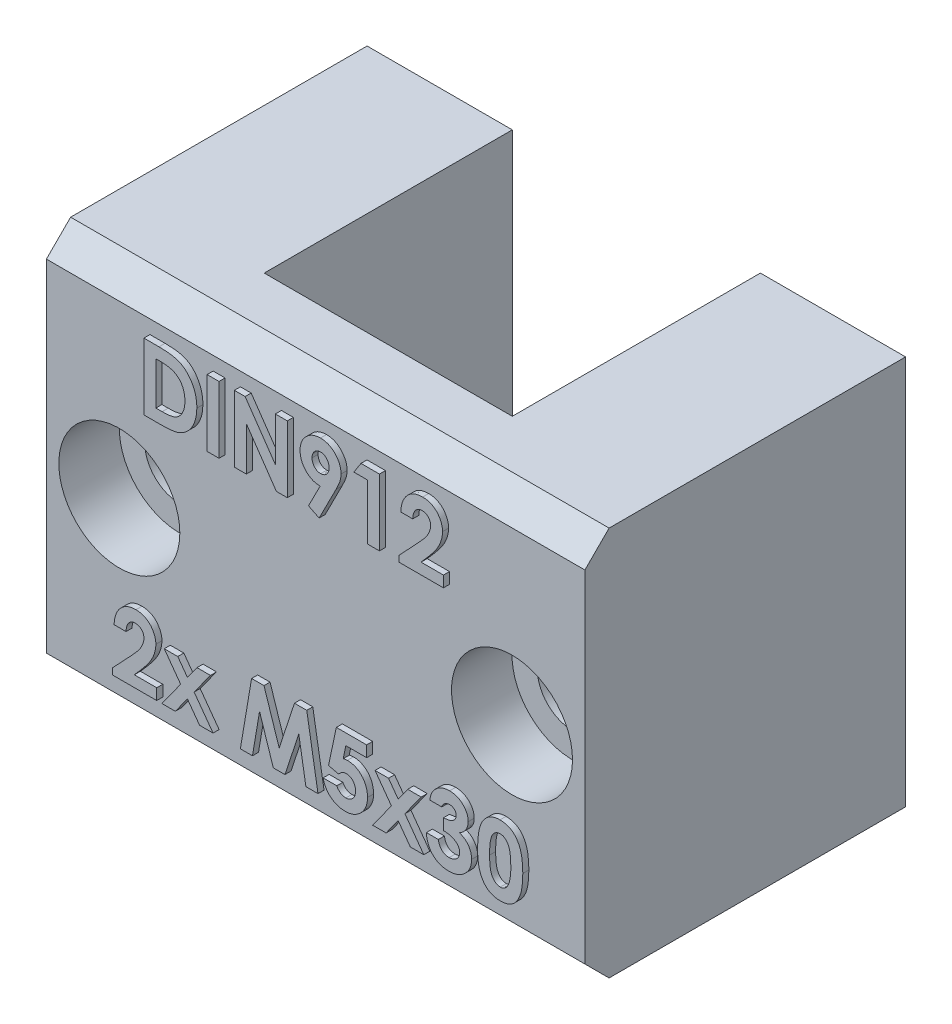
from build123d import *

# Parameters (mm, degrees)
SKETCH1_W                                           = 44.5
SKETCH1_H                                           = 32.2
BOSS_EXTRUDE1_DEPTH                                 = 6
SKETCH2_W                                           = 12
SKETCH2_H                                           = 32.2
BOSS_EXTRUDE2_DEPTH                                 = 20.5
CBORE_FOR_M5_HEX_SOCKET_HEAD_CAP_SCREW1_D           = 5.8
CBORE_FOR_M5_HEX_SOCKET_HEAD_CAP_SCREW1_CBORE_D     = 10
CBORE_FOR_M5_HEX_SOCKET_HEAD_CAP_SCREW1_CBORE_DEPTH = 5
SKETCH6_W                                           = 18.5
SKETCH6_H                                           = 30.2
CUT_EXTRUDE1_DEPTH                                  = 1
CHAMFER1_SIZE                                       = 2
SKETCH7_W                                           = 0.987179487
SKETCH7_H                                           = 5.5
BOSS_EXTRUDE3_DEPTH                                 = 0.5


with BuildPart() as part:
    # Sketch1 → Boss-Extrude1 (new body)
    with BuildSketch(Plane.XY):
        with Locations((22.25, 16.1)):
            Rectangle(SKETCH1_W, SKETCH1_H)
    extrude(amount=BOSS_EXTRUDE1_DEPTH)

    # Sketch2 → Boss-Extrude2 (add)
    with BuildSketch(Plane(origin=(0, 0, 0), x_dir=(-1, 0, 0), z_dir=(0, 0, -1))):
        with Locations((-38.5, 16.1)):
            Rectangle(SKETCH2_W, SKETCH2_H)
        with Locations((-6, 16.1)):
            Rectangle(SKETCH2_W, SKETCH2_H)
    extrude(amount=BOSS_EXTRUDE2_DEPTH)

    # CBORE for M5 Hex Socket Head Cap Screw1 (through all)
    with Locations(Plane.XY.offset(6)):
        with Locations((6.025, 16.1), (38.475, 16.1)):
            CounterBoreHole(CBORE_FOR_M5_HEX_SOCKET_HEAD_CAP_SCREW1_D / 2, CBORE_FOR_M5_HEX_SOCKET_HEAD_CAP_SCREW1_CBORE_D / 2, CBORE_FOR_M5_HEX_SOCKET_HEAD_CAP_SCREW1_CBORE_DEPTH)

    # Sketch6 → Cut-Extrude1 (cut)
    with BuildSketch(Plane(origin=(0, 0, 0), x_dir=(-1, 0, 0), z_dir=(0, 0, -1))):
        with Locations((-22.25, 16.1)):
            Rectangle(SKETCH6_W, SKETCH6_H)
    extrude(amount=-CUT_EXTRUDE1_DEPTH, mode=Mode.SUBTRACT)

    # Chamfer1
    chamfer1_edges = [part.edges().sort_by_distance(p)[0] for p in [
        (22.25, 32.2, 6),
        (22.25, 0, 6),
    ]]
    chamfer(chamfer1_edges, length=CHAMFER1_SIZE)

    # Sketch7 → Boss-Extrude3 (add)
    # profile 1 of 13: a face of its own
    with BuildSketch(Plane.XY.offset(6)):
        with BuildLine():
            Line((8.558580457, 29.075557716), (9.802470681, 29.075557716))
            add(Edge.make_bspline(
                [(9.802470681, 29.075557716), (9.899446232, 29.074879824), (10.086901067, 29.07356945), (10.358486038, 29.058804693), (10.611025501, 29.036097544), (10.844682249, 29.004859746), (11.058977246, 28.963523584), (11.253634165, 28.911675471), (11.429306319, 28.85182545), (11.587919919, 28.781399756), (11.73271888, 28.69929039), (11.870210114, 28.607827149), (12.000123662, 28.503659466), (12.124282653, 28.388796945), (12.241084791, 28.261138209), (12.352475248, 28.122797751), (12.455726682, 27.971769442), (12.55396016, 27.811674467), (12.642799269, 27.641834356), (12.720288059, 27.463694754), (12.785200889, 27.278402056), (12.837945924, 27.085758787), (12.879989805, 26.886404466), (12.909407061, 26.679936812), (12.927593101, 26.466546982), (12.929437923, 26.321922217), (12.930375329, 26.248434319)],
                knots=[0, 0, 0, 0, 1.44355588, 2.790409838, 4.047694926, 5.217575253, 6.298404546, 7.294384826, 8.214239204, 9.058592145, 9.873746385, 10.689560431, 11.514393297, 12.350027578, 13.205127629, 14.088021785, 14.991911688, 15.926770944, 16.882954281, 17.842803888, 18.816321264, 19.80318086, 20.814351908, 21.847355356, 22.906180909, 24, 24, 24, 24], degree=3))
            add(Edge.make_bspline(
                [(12.930375329, 26.248434319), (12.927920695, 26.144738112), (12.923088604, 25.940606058), (12.88238577, 25.641044621), (12.816555505, 25.353885105), (12.723992173, 25.081373785), (12.609238421, 24.825937413), (12.472152214, 24.592080503), (12.314743555, 24.381058279), (12.138846264, 24.193921461), (11.948392339, 24.03307483), (11.750472304, 23.89532146), (11.54315806, 23.786691434), (11.360485237, 23.717803753), (11.20208511, 23.674961575), (11.063011513, 23.649641436), (10.905038096, 23.626421341), (10.726691895, 23.608477351), (10.528755276, 23.592475721), (10.310439262, 23.583781059), (10.072450696, 23.576557085), (9.907145136, 23.575899568), (9.821200649, 23.575557716)],
                knots=[0, 0, 0, 0, 1.315458931, 2.589557908, 3.828601765, 5.048913369, 6.235739168, 7.376350998, 8.481830359, 9.569842114, 10.627874879, 11.640079404, 12.624025415, 13.590060155, 14.111227486, 14.704434459, 15.382649715, 16.137166398, 16.978595427, 17.902333227, 18.909396075, 20, 20, 20, 20], degree=3))
            Line((9.821200649, 23.575557716), (8.558580457, 23.575557716))
            Line((8.558580457, 23.575557716), (8.558580457, 29.075557716))
        make_face()
        with BuildLine():
            Line((9.545759944, 28.088378229), (9.545759944, 24.562737203))
            Line((9.545759944, 24.562737203), (10.061384944, 24.562737203))
            add(Edge.make_bspline(
                [(10.061384944, 24.562737203), (10.1227364, 24.562849625), (10.240735675, 24.563065848), (10.411099916, 24.573364761), (10.568643643, 24.58370203), (10.712933173, 24.603322512), (10.845018601, 24.625178347), (10.96308542, 24.655593736), (11.069567498, 24.687542524), (11.163164179, 24.728217292), (11.248891112, 24.773999451), (11.328264461, 24.827638557), (11.404881965, 24.887202761), (11.477311199, 24.954443932), (11.545826289, 25.028471669), (11.610021857, 25.109667406), (11.670754745, 25.197783411), (11.726466054, 25.293285575), (11.777375346, 25.395165374), (11.822537593, 25.502435954), (11.859983759, 25.615990648), (11.891106721, 25.734766447), (11.913347605, 25.859797429), (11.931747695, 25.990157507), (11.941233478, 26.126363156), (11.942535343, 26.219042033), (11.943195842, 26.266062524)],
                knots=[0, 0, 0, 0, 1.50275155, 2.890291501, 4.180787663, 5.369391935, 6.45668281, 7.458360028, 8.354766181, 9.177074746, 9.954075863, 10.732690366, 11.5210699, 12.329727389, 13.151100085, 13.990027547, 14.863562427, 15.770965086, 16.696477834, 17.652329173, 18.619756807, 19.62365428, 20.657822005, 21.729286259, 22.847956731, 24, 24, 24, 24], degree=3))
            add(Edge.make_bspline(
                [(11.943195842, 26.266062524), (11.941880352, 26.338116982), (11.939315248, 26.478617591), (11.914577947, 26.683259796), (11.874310339, 26.875961089), (11.816852342, 27.056006303), (11.744424757, 27.22390146), (11.65376475, 27.378224133), (11.54877398, 27.52156673), (11.465750143, 27.605656097), (11.424265553, 27.647673101)],
                knots=[0, 0, 0, 0, 1.13821349, 2.219428113, 3.251817212, 4.244760574, 5.201143372, 6.134805572, 7.068016741, 8, 8, 8, 8], degree=3))
            add(Edge.make_bspline(
                [(11.424265553, 27.647673101), (11.383357819, 27.683477269), (11.299808405, 27.756603227), (11.15312309, 27.844226826), (10.99148347, 27.921212746), (10.811191714, 27.982253995), (10.613990264, 28.030528017), (10.398704582, 28.06382143), (10.16648757, 28.085215424), (10.005613035, 28.087301374), (9.922562829, 28.088378229)],
                knots=[0, 0, 0, 0, 0.813307809, 1.661089106, 2.549956539, 3.493439533, 4.508053171, 5.589449661, 6.755572447, 8, 8, 8, 8], degree=3))
            Line((9.922562829, 28.088378229), (9.545759944, 28.088378229))
        make_face(mode=Mode.SUBTRACT)
    # profile 2 of 13: a face of its own
    with BuildSketch(Plane.XY.offset(6)):
        with Locations((14.270118918, 26.325557716)):
            Rectangle(SKETCH7_W, SKETCH7_H)
    # profile 3 of 13: a face of its own
    with BuildSketch(Plane.XY.offset(6)):
        Polygon((16.032939431, 29.075557716), (16.922062027, 29.075557716), (19.417554816, 25.456266851), (19.417554816, 29.075557716), (20.404734303, 29.075557716), (20.404734303, 23.575557716), (19.50900113, 23.575557716), (17.020118919, 27.183830953), (17.020118919, 23.575557716), (16.032939431, 23.575557716), align=None)
    # profile 4 of 13: a face of its own
    with BuildSketch(Plane.XY.offset(6)):
        with BuildLine():
            Line((23.035743919, 23.434532075), (22.160944239, 23.875237203))
            Line((22.160944239, 23.875237203), (23.119477893, 25.761455152))
            add(Edge.make_bspline(
                [(23.119477893, 25.761455152), (23.062845524, 25.762898636), (22.951662483, 25.765732544), (22.787954127, 25.789282293), (22.631403769, 25.829483218), (22.480166194, 25.883000777), (22.33633297, 25.954746609), (22.198160005, 26.040371496), (22.067560079, 26.143248566), (21.943920864, 26.258886646), (21.831034309, 26.386704156), (21.733051168, 26.524169725), (21.64764759, 26.667796254), (21.581233083, 26.820826216), (21.527888613, 26.980407512), (21.488912454, 27.147366153), (21.467040064, 27.322434646), (21.463982923, 27.441584348), (21.462426611, 27.502240409)],
                knots=[0, 0, 0, 0, 1.014336294, 1.991387562, 2.955278539, 3.906441712, 4.859855302, 5.829322156, 6.813833455, 7.833278715, 8.858926674, 9.863225732, 10.85404919, 11.846815163, 12.845559416, 13.865450493, 14.913355531, 16, 16, 16, 16], degree=3))
            add(Edge.make_bspline(
                [(21.462426611, 27.502240409), (21.463870175, 27.56107619), (21.466714689, 27.677010879), (21.490338649, 27.847165275), (21.529217574, 28.010538353), (21.582558065, 28.167102361), (21.653567833, 28.315801558), (21.73668296, 28.45896423), (21.838287431, 28.593628495), (21.953065917, 28.720377315), (22.078684878, 28.836330106), (22.211956052, 28.938280945), (22.352273473, 29.023502051), (22.497833924, 29.095072058), (22.651268515, 29.148544715), (22.810359945, 29.188889439), (22.976293339, 29.21217411), (23.088925467, 29.215101847), (23.145920201, 29.216583357)],
                knots=[0, 0, 0, 0, 1.055538678, 2.079917126, 3.075849687, 4.065898488, 5.041806164, 6.028602842, 7.031727914, 8.062953097, 9.093756959, 10.095582084, 11.068815425, 12.035667573, 13.000833448, 13.979119574, 14.977382875, 16, 16, 16, 16], degree=3))
            add(Edge.make_bspline(
                [(23.145920201, 29.216583357), (23.20551509, 29.215356661), (23.322700375, 29.212944528), (23.494243897, 29.186327599), (23.658369794, 29.14549236), (23.815744939, 29.090029775), (23.964415584, 29.014755568), (24.105625728, 28.924538906), (24.238905663, 28.817383686), (24.362824059, 28.696378455), (24.475526456, 28.564762626), (24.575423107, 28.426992605), (24.659340535, 28.28333777), (24.728074042, 28.135080192), (24.781617098, 27.981987608), (24.818421125, 27.823842861), (24.842854917, 27.660916387), (24.845634995, 27.550440197), (24.847041995, 27.494528069)],
                knots=[0, 0, 0, 0, 1.062826075, 2.08990367, 3.089830715, 4.078784409, 5.060762809, 6.057138927, 7.064407536, 8.107320944, 9.143871033, 10.153461498, 11.140480137, 12.108246174, 13.065926856, 14.029354859, 15.002654194, 16, 16, 16, 16], degree=3))
            add(Edge.make_bspline(
                [(24.847041995, 27.494528069), (24.846274182, 27.451885216), (24.844727633, 27.365992922), (24.829520792, 27.237188118), (24.806448948, 27.108026318), (24.779669191, 26.999433279), (24.75159434, 26.907895943), (24.724274313, 26.830243489), (24.689221915, 26.744034686), (24.650082408, 26.648691695), (24.604754253, 26.544632607), (24.552297654, 26.432354864), (24.495882943, 26.310193275), (24.454299732, 26.226660846), (24.432779175, 26.183430312)],
                knots=[0, 0, 0, 0, 1.105131805, 2.225983929, 3.357782449, 4.505488967, 5.122909461, 5.839607681, 6.638776516, 7.535249922, 8.51168636, 9.581005249, 10.748097757, 12, 12, 12, 12], degree=3))
            Line((24.432779175, 26.183430312), (23.035743919, 23.434532075))
        make_face()
        with BuildLine():
            add(Edge.make_bspline(
                [(23.167955457, 26.678121819), (23.215256985, 26.680906597), (23.307673461, 26.686347423), (23.440423583, 26.728417047), (23.559228193, 26.800409599), (23.664529031, 26.896052663), (23.751546421, 27.012741576), (23.814813757, 27.145581531), (23.853784489, 27.291821559), (23.857797584, 27.393653336), (23.859862508, 27.446050505)],
                knots=[0, 0, 0, 0, 0.984774978, 1.924027336, 2.867853169, 3.859505234, 4.871392407, 5.881338128, 6.909850265, 8, 8, 8, 8], degree=3))
            add(Edge.make_bspline(
                [(23.859862508, 27.446050505), (23.857375533, 27.499537656), (23.852537771, 27.603582935), (23.813193716, 27.753333284), (23.745962639, 27.888698718), (23.654498604, 28.006368558), (23.547715536, 28.104843182), (23.428305112, 28.176776243), (23.299166866, 28.221257342), (23.209798681, 28.22666961), (23.164650169, 28.22940387)],
                knots=[0, 0, 0, 0, 1.104110315, 2.147758178, 3.172670271, 4.206310416, 5.210906102, 6.157051016, 7.068948237, 8, 8, 8, 8], degree=3))
            add(Edge.make_bspline(
                [(23.164650169, 28.22940387), (23.116930725, 28.226738319), (23.023233987, 28.221504533), (22.888835053, 28.177130251), (22.764940334, 28.106578545), (22.656745891, 28.007769801), (22.56310775, 27.891649635), (22.497811318, 27.755827282), (22.456502531, 27.60712195), (22.451946243, 27.502890084), (22.449606098, 27.449355793)],
                knots=[0, 0, 0, 0, 0.970967322, 1.90648639, 2.855811969, 3.858352357, 4.877096915, 5.878517833, 6.91039038, 8, 8, 8, 8], degree=3))
            add(Edge.make_bspline(
                [(22.449606098, 27.449355793), (22.452050524, 27.396584594), (22.456804677, 27.293950122), (22.496649316, 27.14688071), (22.561552239, 27.013337754), (22.650279165, 26.895728583), (22.759568888, 26.799614275), (22.883658955, 26.728388589), (23.022078554, 26.686233351), (23.118454507, 26.680874335), (23.167955457, 26.678121819)],
                knots=[0, 0, 0, 0, 1.075706617, 2.092137047, 3.084482865, 4.090466434, 5.0784141, 6.035155512, 6.990809768, 8, 8, 8, 8], degree=3))
        make_face(mode=Mode.SUBTRACT)
    # profile 5 of 13: a face of its own
    with BuildSketch(Plane.XY.offset(6)):
        Polygon((26.494177412, 29.075557716), (28.020118919, 29.075557716), (28.020118919, 23.575557716), (27.032939431, 23.575557716), (27.032939431, 28.15889105), (25.904734303, 28.15889105), align=None)
    # profile 6 of 13: a face of its own
    with BuildSketch(Plane.XY.offset(6)):
        with BuildLine():
            Line((30.770118919, 27.242224383), (29.782939431, 27.242224383))
            add(Edge.make_bspline(
                [(29.782939431, 27.242224383), (29.787202908, 27.316899288), (29.795533486, 27.462809571), (29.828670418, 27.674748927), (29.873072771, 27.875008314), (29.932333605, 28.0628872), (30.00679872, 28.238317319), (30.094551937, 28.401896719), (30.197835152, 28.552764152), (30.314450157, 28.69019205), (30.442417152, 28.813479886), (30.579079415, 28.922794626), (30.72652738, 29.012998399), (30.882067052, 29.087227753), (31.045671946, 29.146533557), (31.218890021, 29.186184286), (31.400221462, 29.213036149), (31.524357516, 29.215385795), (31.587626931, 29.216583357)],
                knots=[0, 0, 0, 0, 1.199038563, 2.342849363, 3.436047546, 4.486744587, 5.497670872, 6.488682221, 7.459191391, 8.424610317, 9.374430501, 10.305433194, 11.225809216, 12.140057399, 13.06607119, 14.010487599, 14.985989317, 16, 16, 16, 16], degree=3))
            add(Edge.make_bspline(
                [(31.587626931, 29.216583357), (31.665289241, 29.214160088), (31.816904268, 29.2094293), (32.037212929, 29.169074103), (32.242957131, 29.101573801), (32.433987317, 29.007258078), (32.608677213, 28.887439838), (32.76699785, 28.744576196), (32.904161362, 28.575669799), (33.021037403, 28.387748565), (33.118147425, 28.188766426), (33.186198084, 27.983010644), (33.230927049, 27.775941141), (33.23569767, 27.636511018), (33.238067636, 27.567244415)],
                knots=[0, 0, 0, 0, 1.075374347, 2.099382735, 3.09057751, 4.06680945, 5.040638231, 6.016817125, 7.011024321, 8.044445721, 9.0776792, 10.070479129, 11.0414456, 12, 12, 12, 12], degree=3))
            add(Edge.make_bspline(
                [(33.238067636, 27.567244415), (33.237144897, 27.525347078), (33.235287649, 27.441018087), (33.222373963, 27.313407626), (33.20300088, 27.183421452), (33.173790994, 27.051171017), (33.137363871, 26.916619247), (33.093172505, 26.779363477), (33.040191835, 26.640181895), (32.979306, 26.497508037), (32.906669044, 26.350878697), (32.822093406, 26.198095843), (32.723334256, 26.039295007), (32.611584481, 25.873579547), (32.486301337, 25.701210822), (32.346873236, 25.52270806), (32.19490606, 25.337442275), (32.08705068, 25.213602494), (32.031637348, 25.149976787)],
                knots=[0, 0, 0, 0, 0.728284026, 1.46585585, 2.227944881, 3.01186502, 3.81876927, 4.650621989, 5.517437689, 6.406905708, 7.346299482, 8.360816762, 9.441613733, 10.596154504, 11.834900912, 13.145207542, 14.533280747, 16, 16, 16, 16], degree=3))
            Line((32.031637348, 25.149976787), (31.457618919, 24.492224383))
            Line((31.457618919, 24.492224383), (33.308580457, 24.492224383))
            Line((33.308580457, 24.492224383), (33.308580457, 23.575557716))
            Line((33.308580457, 23.575557716), (29.64191379, 23.575557716))
            Line((29.64191379, 23.575557716), (29.64191379, 24.075758037))
            Line((29.64191379, 24.075758037), (31.270319239, 25.808830953))
            add(Edge.make_bspline(
                [(31.270319239, 25.808830953), (31.317465761, 25.859385229), (31.408774594, 25.957293867), (31.538697652, 26.10108312), (31.656266544, 26.237535688), (31.759043381, 26.368104517), (31.85242176, 26.488554485), (31.932237948, 26.602516104), (31.999222198, 26.70895912), (32.071943102, 26.837310808), (32.141004056, 26.990393036), (32.204371661, 27.166750039), (32.242998602, 27.335306718), (32.248330341, 27.445141874), (32.250888149, 27.497833357)],
                knots=[0, 0, 0, 0, 1.246127091, 2.413378631, 3.493388633, 4.492180848, 5.408488754, 6.240484944, 6.999099869, 7.674939598, 8.898438119, 10.020720584, 11.050475521, 12, 12, 12, 12], degree=3))
            add(Edge.make_bspline(
                [(32.250888149, 27.497833357), (32.248975738, 27.548808302), (32.245270134, 27.647580431), (32.204548553, 27.788083259), (32.141461268, 27.915294226), (32.052562373, 28.025412127), (31.944877968, 28.115903307), (31.820438523, 28.183208105), (31.680258586, 28.222042665), (31.581989779, 28.226903364), (31.531437027, 28.22940387)],
                knots=[0, 0, 0, 0, 1.062038974, 2.057870785, 3.028805853, 4.01125022, 4.991535629, 5.949134679, 6.94496649, 8, 8, 8, 8], degree=3))
            add(Edge.make_bspline(
                [(31.531437027, 28.22940387), (31.505320832, 28.228480153), (31.453906908, 28.226661668), (31.378332458, 28.214556506), (31.306417939, 28.193222421), (31.237362902, 28.16463775), (31.171904322, 28.126748564), (31.110207305, 28.080044105), (31.051621796, 28.025711241), (30.99641649, 27.963919862), (30.946172456, 27.894960664), (30.901545888, 27.81946345), (30.864647145, 27.737475083), (30.832160151, 27.650077934), (30.807104627, 27.556333286), (30.788861097, 27.456802191), (30.774991759, 27.351646573), (30.771772747, 27.279361974), (30.770118919, 27.242224383)],
                knots=[0, 0, 0, 0, 0.903469896, 1.778625579, 2.63899355, 3.493148037, 4.358286772, 5.247621495, 6.164656832, 7.118446693, 8.109501108, 9.111810964, 10.146451449, 11.215617525, 12.33435995, 13.498009769, 14.714554818, 16, 16, 16, 16], degree=3))
        make_face()
    # profile 7 of 13: a face of its own
    with BuildSketch(Plane.XY.offset(6)):
        with BuildLine():
            Line((7.077811226, 7.331967973), (6.090631739, 7.331967973))
            add(Edge.make_bspline(
                [(6.090631739, 7.331967973), (6.094895216, 7.406642878), (6.103225794, 7.55255316), (6.136362726, 7.764492517), (6.180765078, 7.964751903), (6.240025912, 8.15263079), (6.314491027, 8.328060908), (6.402244245, 8.491640309), (6.505527459, 8.642507742), (6.622142465, 8.77993564), (6.75010946, 8.903223476), (6.886771723, 9.012538216), (7.034219688, 9.102741989), (7.18975936, 9.176971342), (7.353364254, 9.236277147), (7.526582329, 9.275927876), (7.707913769, 9.302779739), (7.832049824, 9.305129384), (7.895319239, 9.306326947)],
                knots=[0, 0, 0, 0, 1.199038563, 2.342849363, 3.436047546, 4.486744587, 5.497670872, 6.488682221, 7.459191391, 8.424610317, 9.374430501, 10.305433194, 11.225809216, 12.140057399, 13.06607119, 14.010487599, 14.985989317, 16, 16, 16, 16], degree=3))
            add(Edge.make_bspline(
                [(7.895319239, 9.306326947), (7.972981548, 9.303903678), (8.124596576, 9.29917289), (8.344905237, 9.258817693), (8.550649439, 9.191317391), (8.741679624, 9.097001668), (8.91636952, 8.977183427), (9.074690158, 8.834319786), (9.211853669, 8.665413388), (9.328729711, 8.477492155), (9.425839733, 8.278510016), (9.493890391, 8.072754233), (9.538619357, 7.865684731), (9.543389978, 7.726254608), (9.545759944, 7.656988005)],
                knots=[0, 0, 0, 0, 1.075374347, 2.099382735, 3.09057751, 4.06680945, 5.040638231, 6.016817125, 7.011024321, 8.044445721, 9.0776792, 10.070479129, 11.0414456, 12, 12, 12, 12], degree=3))
            add(Edge.make_bspline(
                [(9.545759944, 7.656988005), (9.544837204, 7.615090667), (9.542979957, 7.530761676), (9.53006627, 7.403151216), (9.510693188, 7.273165042), (9.481483302, 7.140914607), (9.445056178, 7.006362837), (9.400864813, 6.869107066), (9.347884142, 6.729925484), (9.286998307, 6.587251626), (9.214361352, 6.440622286), (9.129785714, 6.287839433), (9.031026564, 6.129038597), (8.919276788, 5.963323137), (8.793993645, 5.790954412), (8.654565543, 5.61245165), (8.502598367, 5.427185865), (8.394742988, 5.303346084), (8.339329656, 5.239720376)],
                knots=[0, 0, 0, 0, 0.728284026, 1.46585585, 2.227944881, 3.01186502, 3.81876927, 4.650621989, 5.517437689, 6.406905708, 7.346299482, 8.360816762, 9.441613733, 10.596154504, 11.834900912, 13.145207542, 14.533280747, 16, 16, 16, 16], degree=3))
            Line((8.339329656, 5.239720376), (7.765311226, 4.581967973))
            Line((7.765311226, 4.581967973), (9.616272765, 4.581967973))
            Line((9.616272765, 4.581967973), (9.616272765, 3.665301306))
            Line((9.616272765, 3.665301306), (5.949606098, 3.665301306))
            Line((5.949606098, 3.665301306), (5.949606098, 4.165501626))
            Line((5.949606098, 4.165501626), (7.578011547, 5.898574543))
            add(Edge.make_bspline(
                [(7.578011547, 5.898574543), (7.625158069, 5.949128818), (7.716466901, 6.047037457), (7.84638996, 6.190826709), (7.963958851, 6.327279278), (8.066735689, 6.457848107), (8.160114068, 6.578298074), (8.239930255, 6.692259694), (8.306914506, 6.79870271), (8.37963541, 6.927054398), (8.448696364, 7.080136626), (8.512063969, 7.256493629), (8.550690909, 7.425050308), (8.556022649, 7.534885463), (8.558580457, 7.587576947)],
                knots=[0, 0, 0, 0, 1.246127091, 2.413378631, 3.493388633, 4.492180848, 5.408488754, 6.240484944, 6.999099869, 7.674939598, 8.898438119, 10.020720584, 11.050475521, 12, 12, 12, 12], degree=3))
            add(Edge.make_bspline(
                [(8.558580457, 7.587576947), (8.556668046, 7.638551892), (8.552962442, 7.737324021), (8.512240861, 7.877826849), (8.449153576, 8.005037816), (8.360254681, 8.115155716), (8.252570276, 8.205646897), (8.128130831, 8.272951695), (7.987950893, 8.311786254), (7.889682086, 8.316646954), (7.839129335, 8.31914746)],
                knots=[0, 0, 0, 0, 1.062038974, 2.057870785, 3.028805853, 4.01125022, 4.991535629, 5.949134679, 6.94496649, 8, 8, 8, 8], degree=3))
            add(Edge.make_bspline(
                [(7.839129335, 8.31914746), (7.81301314, 8.318223743), (7.761599216, 8.316405258), (7.686024765, 8.304300096), (7.614110246, 8.282966011), (7.54505521, 8.25438134), (7.47959663, 8.216492154), (7.417899613, 8.169787695), (7.359314104, 8.11545483), (7.304108798, 8.053663451), (7.253864763, 7.984704254), (7.209238195, 7.90920704), (7.172339453, 7.827218673), (7.139852459, 7.739821523), (7.114796935, 7.646076876), (7.096553405, 7.546545781), (7.082684067, 7.441390163), (7.079465055, 7.369105564), (7.077811226, 7.331967973)],
                knots=[0, 0, 0, 0, 0.903469896, 1.778625579, 2.63899355, 3.493148037, 4.358286772, 5.247621495, 6.164656832, 7.118446693, 8.109501108, 9.111810964, 10.146451449, 11.215617525, 12.33435995, 13.498009769, 14.714554818, 16, 16, 16, 16], degree=3))
        make_face()
    # profile 8 of 13: a face of its own
    with BuildSketch(Plane.XY.offset(6)):
        Polygon((10.240972284, 7.684532075), (11.354854495, 7.684532075), (12.149225489, 6.589379832), (12.940291194, 7.684532075), (14.054173406, 7.684532075), (12.707819239, 5.81924762), (14.270118919, 3.665301306), (13.156236707, 3.665301306), (12.152530777, 5.049115409), (11.153231899, 3.665301306), (10.039349688, 3.665301306), (11.593937027, 5.81924762), align=None)
    # profile 9 of 13: a face of its own
    with BuildSketch(Plane.XY.offset(6)):
        Polygon((17.455315233, 9.165301306), (18.479954656, 9.165301306), (19.734862508, 5.328963165), (20.998584463, 9.165301306), (22.013308021, 9.165301306), (22.943195842, 3.665301306), (21.943896963, 3.665301306), (21.35665738, 7.139159479), (20.213027572, 3.665301306), (19.250086867, 3.665301306), (18.113067636, 7.139159479), (17.526929816, 3.665301306), (16.526529175, 3.665301306), align=None)
    # profile 10 of 13: a face of its own
    with BuildSketch(Plane.XY.offset(6)):
        with BuildLine():
            Line((24.45811972, 9.165301306), (26.962426611, 9.165301306))
            Line((26.962426611, 9.165301306), (26.962426611, 8.248634639))
            Line((26.962426611, 8.248634639), (25.240371322, 8.248634639))
            Line((25.240371322, 8.248634639), (25.025527572, 7.208570537))
            add(Edge.make_bspline(
                [(25.025527572, 7.208570537), (25.054803109, 7.216724143), (25.112540481, 7.23280473), (25.199521905, 7.248931525), (25.283819026, 7.2593844), (25.339134282, 7.260778674), (25.365972284, 7.261455152)],
                knots=[0, 0, 0, 0, 1.05461699, 2.079921384, 3.068411212, 4, 4, 4, 4], degree=3))
            add(Edge.make_bspline(
                [(25.365972284, 7.261455152), (25.424455101, 7.260115052), (25.539737615, 7.25747342), (25.708381305, 7.232395716), (25.869867601, 7.192899092), (26.023702337, 7.136568756), (26.169735237, 7.06325337), (26.308143321, 6.974562305), (26.439096462, 6.870339786), (26.560268381, 6.750520562), (26.671606203, 6.618956342), (26.768408088, 6.476655716), (26.851082939, 6.325647754), (26.916839657, 6.164993793), (26.968740465, 5.995702849), (27.006245148, 5.817666434), (27.02842354, 5.630673548), (27.03141416, 5.503101672), (27.032939431, 5.438037684)],
                knots=[0, 0, 0, 0, 1.01440847, 1.999622559, 2.951875003, 3.895578053, 4.836219714, 5.782137149, 6.743708247, 7.735272588, 8.734977101, 9.730283169, 10.717124674, 11.717316708, 12.737475749, 13.78628267, 14.87096371, 16, 16, 16, 16], degree=3))
            add(Edge.make_bspline(
                [(27.032939431, 5.438037684), (27.031075526, 5.372235069), (27.027397495, 5.242387275), (27.003401715, 5.051465087), (26.961048732, 4.868604732), (26.902872673, 4.693316697), (26.826229439, 4.526889308), (26.73405546, 4.367598501), (26.624792323, 4.216626641), (26.499512274, 4.075521372), (26.363316428, 3.946548447), (26.218300001, 3.833090718), (26.065481779, 3.737616959), (25.904858073, 3.66045802), (25.737350433, 3.599411241), (25.56290802, 3.5549721), (25.380683064, 3.529488721), (25.256975995, 3.526032445), (25.194097284, 3.524275665)],
                knots=[0, 0, 0, 0, 1.06808661, 2.107647099, 3.116961351, 4.110378221, 5.100014249, 6.085620622, 7.093190682, 8.119403071, 9.144090782, 10.133780668, 11.103064255, 12.062861538, 13.020824475, 13.992378307, 14.979551724, 16, 16, 16, 16], degree=3))
            add(Edge.make_bspline(
                [(25.194097284, 3.524275665), (25.137866724, 3.525712821), (25.026968293, 3.528547193), (24.863619772, 3.545968737), (24.706133658, 3.576770192), (24.555346031, 3.621347871), (24.409670352, 3.676212818), (24.270790674, 3.744831802), (24.13794383, 3.825898226), (24.011507053, 3.917932626), (23.893534763, 4.021605808), (23.785862157, 4.135093968), (23.687837372, 4.256966643), (23.601557984, 4.388727371), (23.527294454, 4.530181484), (23.46143604, 4.679661913), (23.407530268, 4.838729709), (23.380174642, 4.949004343), (23.366272765, 5.005044896)],
                knots=[0, 0, 0, 0, 1.054957082, 2.080596141, 3.077793124, 4.061112343, 5.027190972, 5.994718051, 6.962465889, 7.943658696, 8.924948258, 9.904494768, 10.875059, 11.855380583, 12.854004648, 13.869083016, 14.917087635, 16, 16, 16, 16], degree=3))
            Line((23.366272765, 5.005044896), (24.494477893, 5.005044896))
            add(Edge.make_bspline(
                [(24.494477893, 5.005044896), (24.51510151, 4.966211075), (24.555181156, 4.890741976), (24.631421503, 4.790545408), (24.716767732, 4.705102079), (24.810449973, 4.633577189), (24.913075228, 4.579991959), (25.020461712, 4.5393554), (25.133958477, 4.515873037), (25.211254785, 4.512937509), (25.250287188, 4.511455152)],
                knots=[0, 0, 0, 0, 1.104910296, 2.147267069, 3.153527244, 4.136738762, 5.099945312, 6.05603338, 7.018353, 8, 8, 8, 8], degree=3))
            add(Edge.make_bspline(
                [(25.250287188, 4.511455152), (25.277492249, 4.512478732), (25.331018666, 4.514492644), (25.409881376, 4.525146742), (25.485159298, 4.545325362), (25.557412105, 4.573268061), (25.626833886, 4.608115761), (25.692429455, 4.652108713), (25.755340059, 4.702746231), (25.814607941, 4.760852955), (25.86828756, 4.825628436), (25.915358713, 4.895234106), (25.957446815, 4.968123312), (25.988622116, 5.047183379), (26.014152052, 5.130053544), (26.032953329, 5.217358924), (26.044189212, 5.309201483), (26.045229354, 5.371899823), (26.045759944, 5.403883037)],
                knots=[0, 0, 0, 0, 0.978869489, 1.925942215, 2.855067702, 3.774946051, 4.70828698, 5.642468714, 6.60995405, 7.609372294, 8.622401667, 9.629904756, 10.629323, 11.642352373, 12.678539694, 13.745912462, 14.850161547, 16, 16, 16, 16], degree=3))
            add(Edge.make_bspline(
                [(26.045759944, 5.403883037), (26.045144133, 5.435123847), (26.043945443, 5.495934843), (26.034029636, 5.585227168), (26.016290449, 5.669949424), (25.992120654, 5.750750521), (25.961180432, 5.827139795), (25.923369411, 5.899571953), (25.878526061, 5.967680876), (25.826409626, 6.030079934), (25.770833195, 6.087314124), (25.711126251, 6.137370691), (25.64782672, 6.178914166), (25.582901558, 6.215182828), (25.513759186, 6.24157837), (25.441954338, 6.259756006), (25.367562526, 6.273094023), (25.316821486, 6.273877681), (25.291052412, 6.274275665)],
                knots=[0, 0, 0, 0, 1.166249705, 2.270133367, 3.348514167, 4.393962215, 5.415026464, 6.420877785, 7.440098956, 8.453121383, 9.451844239, 10.415694839, 11.355045125, 12.27538808, 13.187007209, 14.108269027, 15.039275622, 16, 16, 16, 16], degree=3))
            add(Edge.make_bspline(
                [(25.291052412, 6.274275665), (25.263061209, 6.273213554), (25.206960833, 6.271084857), (25.123609716, 6.253764213), (25.041263582, 6.225732914), (24.959464501, 6.187059294), (24.879024471, 6.136447729), (24.797820641, 6.077086166), (24.718571076, 6.004661424), (24.668181999, 5.950719312), (24.642114111, 5.922813325)],
                knots=[0, 0, 0, 0, 0.88288272, 1.769486374, 2.674910571, 3.623812639, 4.617874466, 5.670434592, 6.794841017, 8, 8, 8, 8], degree=3))
            Line((24.642114111, 5.922813325), (23.811384944, 6.113418293))
            Line((23.811384944, 6.113418293), (24.45811972, 9.165301306))
        make_face()
    # profile 11 of 13: a face of its own
    with BuildSketch(Plane.XY.offset(6)):
        Polygon((27.657638951, 7.684532075), (28.771521162, 7.684532075), (29.565892156, 6.589379832), (30.356957861, 7.684532075), (31.470840072, 7.684532075), (30.124485906, 5.81924762), (31.686785585, 3.665301306), (30.572903374, 3.665301306), (29.569197444, 5.049115409), (28.569898566, 3.665301306), (27.456016354, 3.665301306), (29.010603694, 5.81924762), align=None)
    # profile 12 of 13: a face of its own
    with BuildSketch(Plane.XY.offset(6)):
        with BuildLine():
            Line((33.167554816, 7.825557716), (32.180375329, 7.825557716))
            add(Edge.make_bspline(
                [(32.180375329, 7.825557716), (32.187345191, 7.874903297), (32.201009145, 7.97164204), (32.23370516, 8.11169564), (32.272813121, 8.244546065), (32.321637413, 8.369772604), (32.378900365, 8.487598327), (32.444019675, 8.598427555), (32.517699309, 8.701784588), (32.574175529, 8.764047275), (32.602350489, 8.795108998)],
                knots=[0, 0, 0, 0, 1.111473889, 2.178970933, 3.205615836, 4.199322666, 5.174200091, 6.12565194, 7.064921805, 8, 8, 8, 8], degree=3))
            add(Edge.make_bspline(
                [(32.602350489, 8.795108998), (32.642989136, 8.836092691), (32.723083637, 8.916867243), (32.856930943, 9.020330522), (32.997227637, 9.109870954), (33.146787433, 9.180859256), (33.303283066, 9.238316062), (33.467959045, 9.276909929), (33.640142443, 9.3025173), (33.757635952, 9.305039716), (33.81759488, 9.306326947)],
                knots=[0, 0, 0, 0, 1.01925491, 2.00884431, 2.983262333, 3.955970413, 4.92937149, 5.924503185, 6.940838805, 8, 8, 8, 8], degree=3))
            add(Edge.make_bspline(
                [(33.81759488, 9.306326947), (33.870901452, 9.305068483), (33.975691432, 9.302594597), (34.129706335, 9.282735582), (34.276546656, 9.247905081), (34.41776454, 9.202364983), (34.551283132, 9.140400069), (34.680049317, 9.068471992), (34.800465363, 8.980249216), (34.912813022, 8.880566358), (35.016025773, 8.772749589), (35.105408468, 8.657502329), (35.182252375, 8.537903099), (35.24556159, 8.412958256), (35.294237773, 8.282456376), (35.328020488, 8.147151353), (35.350132095, 8.007341747), (35.352334989, 7.912315041), (35.353452252, 7.864119415)],
                knots=[0, 0, 0, 0, 1.091422571, 2.145516843, 3.172569842, 4.178562979, 5.178154469, 6.181868002, 7.194278174, 8.227918432, 9.254613415, 10.245994977, 11.209837596, 12.161663635, 13.10878368, 14.055455738, 15.013766427, 16, 16, 16, 16], degree=3))
            add(Edge.make_bspline(
                [(35.353452252, 7.864119415), (35.351159561, 7.804433145), (35.346645957, 7.686929231), (35.309608572, 7.514953523), (35.251634992, 7.350514055), (35.167886517, 7.195911583), (35.063179593, 7.051566849), (34.934707704, 6.922305731), (34.786130062, 6.806101588), (34.674590848, 6.743653468), (34.617474688, 6.711675505)],
                knots=[0, 0, 0, 0, 0.992805628, 1.954529043, 2.915727527, 3.886831945, 4.871318353, 5.87440735, 6.911542536, 8, 8, 8, 8], degree=3))
            add(Edge.make_bspline(
                [(34.617474688, 6.711675505), (34.656678344, 6.698804119), (34.73371177, 6.673512423), (34.843205523, 6.623700715), (34.94732157, 6.569264774), (35.044267071, 6.50602456), (35.135006266, 6.436537228), (35.218985997, 6.360208774), (35.296708025, 6.27720563), (35.366903569, 6.187071311), (35.429204857, 6.091247339), (35.485104485, 5.991947191), (35.531112995, 5.887664962), (35.570087931, 5.779591627), (35.599761228, 5.666755878), (35.62065388, 5.549594946), (35.632730346, 5.428376081), (35.634572213, 5.346250373), (35.635503534, 5.304724383)],
                knots=[0, 0, 0, 0, 1.059543567, 2.081955587, 3.086750234, 4.076226789, 5.052108497, 6.020845489, 6.989030705, 7.970690546, 8.952259656, 9.923888338, 10.895517021, 11.877585046, 12.873342345, 13.889638361, 14.932918083, 16, 16, 16, 16], degree=3))
            add(Edge.make_bspline(
                [(35.635503534, 5.304724383), (35.633615622, 5.243698037), (35.629893045, 5.123366511), (35.606226639, 4.946130489), (35.562164057, 4.777151687), (35.504197289, 4.614485752), (35.426875912, 4.46023264), (35.33588165, 4.310852453), (35.224031419, 4.171525655), (35.099729094, 4.038568807), (34.961684114, 3.917690394), (34.812020898, 3.812894249), (34.654030413, 3.722960511), (34.486713096, 3.64994974), (34.310127078, 3.593723096), (34.124665953, 3.553079886), (33.929550464, 3.528213698), (33.796368878, 3.52560695), (33.728352092, 3.524275665)],
                knots=[0, 0, 0, 0, 1.005138573, 1.981928558, 2.936866704, 3.876260664, 4.820238198, 5.773547, 6.751179199, 7.756627054, 8.768222608, 9.766606018, 10.760583154, 11.757261445, 12.767156078, 13.807575856, 14.880313354, 16, 16, 16, 16], degree=3))
            add(Edge.make_bspline(
                [(33.728352092, 3.524275665), (33.664009309, 3.52567928), (33.538195512, 3.528423863), (33.354166502, 3.552179622), (33.179264348, 3.590499589), (33.013042696, 3.64451476), (32.856144645, 3.714563207), (32.707147381, 3.797975189), (32.569024114, 3.899561716), (32.440235877, 4.014736981), (32.323639582, 4.143957088), (32.219429952, 4.284228718), (32.129904827, 4.436085267), (32.054697065, 4.59887794), (31.994394619, 4.772892325), (31.946828227, 4.957774553), (31.913602324, 5.153885829), (31.903483305, 5.288814559), (31.898324047, 5.357608998)],
                knots=[0, 0, 0, 0, 1.066544725, 2.085487077, 3.070979577, 4.031932826, 4.977951092, 5.916076795, 6.857635327, 7.814973522, 8.776389752, 9.738577119, 10.707772778, 11.69409279, 12.707140348, 13.757286496, 14.856535458, 16, 16, 16, 16], degree=3))
            Line((31.898324047, 5.357608998), (32.885503534, 5.357608998))
            add(Edge.make_bspline(
                [(32.885503534, 5.357608998), (32.891759187, 5.323018251), (32.903943713, 5.2556437), (32.927708883, 5.158100327), (32.958678215, 5.068061769), (32.994486468, 4.984727766), (33.033164773, 4.907004171), (33.079897413, 4.837761509), (33.131260068, 4.775119558), (33.205376754, 4.700650116), (33.311331661, 4.624135873), (33.454405888, 4.557641356), (33.613562417, 4.5186674), (33.724828703, 4.513912697), (33.78233847, 4.511455152)],
                knots=[0, 0, 0, 0, 0.928156231, 1.807827665, 2.648129825, 3.438902246, 4.202261636, 4.936546065, 5.639352463, 6.338805438, 7.70633318, 9.064371875, 10.482673459, 12, 12, 12, 12], degree=3))
            add(Edge.make_bspline(
                [(33.78233847, 4.511455152), (33.812855185, 4.511978463), (33.872630603, 4.513003512), (33.960431791, 4.524364809), (34.044074785, 4.543076874), (34.123715375, 4.568505876), (34.199860557, 4.600382721), (34.271055501, 4.641486004), (34.338751339, 4.689274439), (34.402212155, 4.743001326), (34.460851256, 4.8015444), (34.509642438, 4.866370909), (34.554234047, 4.932246228), (34.587214322, 5.003480154), (34.616112148, 5.07623954), (34.633799094, 5.153165323), (34.647154009, 5.232643808), (34.647930143, 5.287035394), (34.648324047, 5.314640248)],
                knots=[0, 0, 0, 0, 1.110435564, 2.175094844, 3.216326037, 4.226890168, 5.215276772, 6.21526065, 7.213097102, 8.228249917, 9.239874822, 10.221364777, 11.178138315, 12.128914389, 13.072518965, 14.022636769, 14.996447288, 16, 16, 16, 16], degree=3))
            add(Edge.make_bspline(
                [(34.648324047, 5.314640248), (34.647278305, 5.344830859), (34.645196473, 5.404933449), (34.62818769, 5.49264054), (34.601327225, 5.577007693), (34.564014758, 5.65766129), (34.514188118, 5.734304058), (34.455393238, 5.808473684), (34.382998055, 5.87630977), (34.303570843, 5.943363685), (34.211466481, 6.001814476), (34.111170579, 6.055755967), (34.000047206, 6.098676741), (33.880808983, 6.137012942), (33.751200407, 6.165013108), (33.612026299, 6.185343958), (33.463511168, 6.200477124), (33.361137758, 6.202648226), (33.308580457, 6.203762844)],
                knots=[0, 0, 0, 0, 0.809814727, 1.612155564, 2.388397, 3.182215007, 3.988903953, 4.837162975, 5.715530372, 6.646997145, 7.623086902, 8.637258368, 9.698941581, 10.815059213, 11.996518529, 13.252603015, 14.589518788, 16, 16, 16, 16], degree=3))
            Line((33.308580457, 6.203762844), (33.308580457, 7.120429511))
            add(Edge.make_bspline(
                [(33.308580457, 7.120429511), (33.374017423, 7.126002332), (33.496437027, 7.136427978), (33.666362002, 7.160808711), (33.809416927, 7.193397576), (33.929040128, 7.232714278), (34.02836757, 7.283207165), (34.115139475, 7.338949084), (34.189871544, 7.403685175), (34.253030167, 7.475485019), (34.303555101, 7.552591318), (34.339313705, 7.633805613), (34.362926819, 7.716615032), (34.36516416, 7.773254179), (34.366272765, 7.801318934)],
                knots=[0, 0, 0, 0, 1.70044513, 3.18119609, 4.440695891, 5.496282586, 6.431922213, 7.318171381, 8.16090191, 8.983045123, 9.787564368, 10.536848927, 11.275007137, 12, 12, 12, 12], degree=3))
            add(Edge.make_bspline(
                [(34.366272765, 7.801318934), (34.364360104, 7.837126515), (34.360626996, 7.907015332), (34.331633656, 8.007040952), (34.281304503, 8.096205501), (34.213821947, 8.174321353), (34.131592105, 8.239569568), (34.035204315, 8.286938659), (33.926750199, 8.314770115), (33.850446884, 8.317655299), (33.810984303, 8.31914746)],
                knots=[0, 0, 0, 0, 1.009664648, 1.970651636, 2.907870547, 3.878035693, 4.867062054, 5.849714035, 6.887914197, 8, 8, 8, 8], degree=3))
            add(Edge.make_bspline(
                [(33.810984303, 8.31914746), (33.775215911, 8.317386867), (33.704240465, 8.313893312), (33.600453119, 8.28781834), (33.50188972, 8.243924369), (33.410591235, 8.183397171), (33.327875578, 8.110706572), (33.259989888, 8.024619645), (33.20352579, 7.930294008), (33.179592146, 7.860606678), (33.167554816, 7.825557716)],
                knots=[0, 0, 0, 0, 0.98818071, 1.960853194, 2.938124878, 3.957524365, 4.978590984, 5.968022688, 6.978025184, 8, 8, 8, 8], degree=3))
        make_face()
    # profile 13 of 13: a face of its own
    with BuildSketch(Plane.XY.offset(6)):
        with BuildLine():
            add(Edge.make_bspline(
                [(37.981156579, 9.306326947), (38.028940163, 9.305617586), (38.122895457, 9.304222793), (38.261273919, 9.289116051), (38.394570638, 9.266293976), (38.523307086, 9.234465141), (38.646556605, 9.19234081), (38.765216231, 9.141918709), (38.877873571, 9.080554093), (38.985965366, 9.011239608), (39.08944998, 8.932765785), (39.18584023, 8.843301575), (39.27689641, 8.744905553), (39.360647487, 8.636090148), (39.438948154, 8.517845151), (39.511541129, 8.390151812), (39.577870695, 8.252385159), (39.638680248, 8.104296579), (39.693056341, 7.94366629), (39.738857258, 7.768651792), (39.778139208, 7.579213118), (39.811295945, 7.374878725), (39.836357079, 7.155377006), (39.853248789, 6.920853785), (39.864840679, 6.67176119), (39.865786728, 6.500885716), (39.866272765, 6.41309778)],
                knots=[0, 0, 0, 0, 0.879237366, 1.728815576, 2.559023295, 3.367336655, 4.166867292, 4.954216142, 5.737608147, 6.525189134, 7.316157332, 8.124696809, 8.942788509, 9.781158001, 10.649253743, 11.551476218, 12.482711956, 13.461909668, 14.496590415, 15.601789533, 16.789733467, 18.056700938, 19.410929216, 20.8549011, 22.384193279, 24, 24, 24, 24], degree=3))
            add(Edge.make_bspline(
                [(39.866272765, 6.41309778), (39.865747491, 6.324211519), (39.864726892, 6.151507108), (39.853730667, 5.900136185), (39.834794647, 5.663910185), (39.810388538, 5.442853547), (39.776958844, 5.237083008), (39.737808026, 5.04606576), (39.691284156, 4.869871042), (39.635116931, 4.708895859), (39.57467546, 4.560547204), (39.508164454, 4.423049162), (39.436743191, 4.296029314), (39.36204986, 4.177571392), (39.279989496, 4.071167475), (39.19455621, 3.973199275), (39.102030083, 3.887398524), (39.006306823, 3.809343438), (38.9038797, 3.74188818), (38.795805018, 3.682892923), (38.680155993, 3.635040763), (38.55904071, 3.59342151), (38.430394735, 3.563543377), (38.296262233, 3.539836061), (38.155128877, 3.526733943), (38.059039604, 3.52510854), (38.009802412, 3.524275665)],
                knots=[0, 0, 0, 0, 1.643780988, 3.193836972, 4.651895693, 6.025988579, 7.305620092, 8.505800249, 9.631074763, 10.672816429, 11.65661981, 12.592235626, 13.49536222, 14.350718032, 15.179365177, 15.97804903, 16.751647189, 17.51006938, 18.259804725, 19.016521909, 19.783502495, 20.571750527, 21.382245291, 22.22305063, 23.089471752, 24, 24, 24, 24], degree=3))
            add(Edge.make_bspline(
                [(38.009802412, 3.524275665), (37.960566549, 3.525124605), (37.864114217, 3.526787667), (37.722599223, 3.539738641), (37.587755886, 3.563639416), (37.458092114, 3.593650892), (37.334510346, 3.634948677), (37.21641801, 3.684232539), (37.104723135, 3.742859695), (36.999116455, 3.810472117), (36.899958541, 3.888004955), (36.80570848, 3.974628909), (36.716574759, 4.070124407), (36.633913322, 4.17556108), (36.556370414, 4.289531567), (36.484754686, 4.413337356), (36.419109176, 4.546798188), (36.35738048, 4.690100095), (36.303746058, 4.846328202), (36.256013912, 5.016877606), (36.216912994, 5.203169977), (36.185465419, 5.405145467), (36.160357693, 5.622376182), (36.141680431, 5.854966973), (36.130623126, 6.103026175), (36.129613231, 6.27352962), (36.129093277, 6.361314928)],
                knots=[0, 0, 0, 0, 0.917216111, 1.796812873, 2.643793957, 3.46689424, 4.273913431, 5.068098542, 5.848489301, 6.620921603, 7.401012384, 8.190319798, 9.003608147, 9.831726257, 10.68377682, 11.569763213, 12.493818149, 13.453288342, 14.474581811, 15.568529029, 16.750744269, 18.018426408, 19.375425659, 20.823733699, 22.36466933, 24, 24, 24, 24], degree=3))
            add(Edge.make_bspline(
                [(36.129093277, 6.361314928), (36.130035126, 6.483285702), (36.131852433, 6.718629881), (36.154882694, 7.058633795), (36.188685275, 7.372908516), (36.23833326, 7.660928339), (36.299722307, 7.923760008), (36.378334177, 8.159672123), (36.467828074, 8.371929059), (36.544088371, 8.497671346), (36.580816034, 8.558229992)],
                knots=[0, 0, 0, 0, 1.288568992, 2.486310467, 3.599230591, 4.627010532, 5.572937695, 6.447898582, 7.252493626, 8, 8, 8, 8], degree=3))
            add(Edge.make_bspline(
                [(36.580816034, 8.558229992), (36.623521211, 8.617722787), (36.707018248, 8.734042925), (36.85301515, 8.886749522), (37.009869814, 9.017351682), (37.180803943, 9.12289376), (37.363114144, 9.206124252), (37.558365642, 9.264909011), (37.765837407, 9.299159751), (37.908311729, 9.303902205), (37.981156579, 9.306326947)],
                knots=[0, 0, 0, 0, 1.058512271, 2.069600068, 3.047294572, 4.004278952, 4.967380941, 5.939006123, 6.946246673, 8, 8, 8, 8], degree=3))
        make_face()
        with BuildLine():
            add(Edge.make_bspline(
                [(38.005395361, 8.31914746), (37.962198604, 8.317100019), (37.877510031, 8.313085949), (37.754622876, 8.279012158), (37.638747962, 8.226383351), (37.55060501, 8.16305281), (37.484630887, 8.102342892), (37.438534294, 8.04740239), (37.394081395, 7.98609275), (37.354818356, 7.915647382), (37.317743799, 7.838597472), (37.281510781, 7.75459326), (37.251809221, 7.661571419), (37.222628225, 7.561116125), (37.19706295, 7.450450055), (37.175644854, 7.328668637), (37.156509668, 7.194979913), (37.143162648, 7.049296319), (37.130719219, 6.891770275), (37.121799181, 6.722050874), (37.118069936, 6.540183903), (37.116884523, 6.414934819), (37.116272765, 6.3502973)],
                knots=[0, 0, 0, 0, 1.076674018, 2.110852608, 3.161083442, 4.239746716, 4.804137807, 5.395870207, 6.026861976, 6.692161227, 7.405688833, 8.16177676, 8.973626916, 9.841385931, 10.773283133, 11.807421078, 12.927755683, 14.143907515, 15.458935494, 16.872852025, 18.386167141, 20, 20, 20, 20], degree=3))
            add(Edge.make_bspline(
                [(37.116272765, 6.3502973), (37.117279645, 6.266556269), (37.119210412, 6.105976633), (37.129322868, 5.875057525), (37.149592446, 5.664902544), (37.174803709, 5.474087389), (37.210213957, 5.303849549), (37.25095574, 5.152578416), (37.30126822, 5.02220233), (37.359413984, 4.910835759), (37.423813038, 4.816096448), (37.493721043, 4.735567607), (37.566757884, 4.66583343), (37.645203277, 4.609189218), (37.728870075, 4.565779704), (37.817059814, 4.534555777), (37.909828537, 4.515442311), (37.973355603, 4.512791888), (38.005395361, 4.511455152)],
                knots=[0, 0, 0, 0, 1.771748488, 3.397459088, 4.888034009, 6.237357457, 7.467047327, 8.564189669, 9.548206622, 10.417051504, 11.216568818, 11.965764335, 12.669334354, 13.348544111, 14.005342236, 14.656555988, 15.322436492, 16, 16, 16, 16], degree=3))
            add(Edge.make_bspline(
                [(38.005395361, 4.511455152), (38.036335616, 4.512369846), (38.096912789, 4.514160704), (38.185247873, 4.532543614), (38.268783806, 4.562430234), (38.347268366, 4.604706956), (38.420982281, 4.658468276), (38.489565283, 4.723950444), (38.552500134, 4.801806166), (38.589166264, 4.859586627), (38.608059624, 4.8893598)],
                knots=[0, 0, 0, 0, 0.992283464, 1.942767638, 2.88273346, 3.832339453, 4.79467288, 5.803907806, 6.868395428, 8, 8, 8, 8], degree=3))
            add(Edge.make_bspline(
                [(38.608059624, 4.8893598), (38.630303373, 4.930043889), (38.676946711, 5.015355125), (38.730922462, 5.159314655), (38.776356242, 5.321677211), (38.815460431, 5.502948082), (38.842205311, 5.703842222), (38.865237969, 5.923085743), (38.876347193, 6.161782668), (38.878154168, 6.327152759), (38.879093277, 6.41309778)],
                knots=[0, 0, 0, 0, 0.710965849, 1.490837728, 2.352621235, 3.297892224, 4.334225155, 5.461620853, 6.680770821, 8, 8, 8, 8], degree=3))
            add(Edge.make_bspline(
                [(38.879093277, 6.41309778), (38.87873052, 6.499788846), (38.878032274, 6.666654347), (38.865221474, 6.906209405), (38.847381457, 7.125003192), (38.821286662, 7.322547231), (38.787710965, 7.499321073), (38.746328792, 7.655313162), (38.697542289, 7.790830929), (38.63968731, 7.905739242), (38.575609326, 8.003395546), (38.50758859, 8.08717708), (38.435337483, 8.158707639), (38.358976831, 8.218256407), (38.276739241, 8.263756132), (38.190195559, 8.295882702), (38.099168362, 8.315318199), (38.037074927, 8.317853811), (38.005395361, 8.31914746)],
                knots=[0, 0, 0, 0, 1.793836731, 3.452829483, 4.963243077, 6.335886805, 7.574563692, 8.684454726, 9.672768357, 10.54971625, 11.340229787, 12.085688095, 12.778991901, 13.440269426, 14.083255152, 14.715733572, 15.344777694, 16, 16, 16, 16], degree=3))
        make_face(mode=Mode.SUBTRACT)
    extrude(amount=BOSS_EXTRUDE3_DEPTH)


solid = part.part
